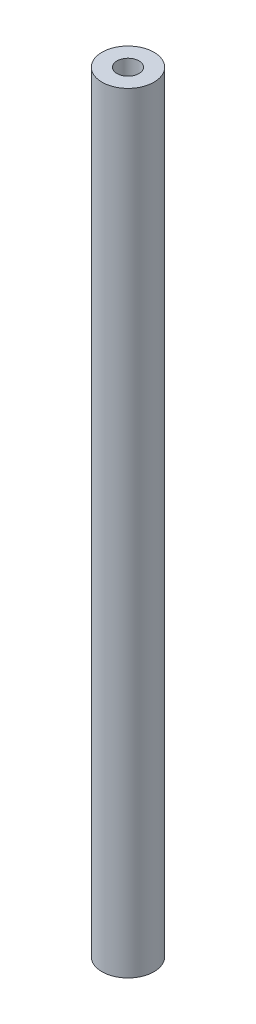
from build123d import *

# Parameters (mm, degrees)
SKETCH1_R           = 4.7625
SKETCH1_R_2         = 2.0193
BOSS_EXTRUDE1_DEPTH = 141.2875


with BuildPart() as part:
    # Sketch1 → Boss-Extrude1 (new body)
    with BuildSketch(Plane(origin=(0, 0, 0), x_dir=(1, 0, 0), z_dir=(0, 1, 0))):
        with Locations(Location((0, 0, 0), (0, 0, 270))):
            Circle(SKETCH1_R)
        with Locations(Location((0, 0, 0), (0, 0, 270))):
            Circle(SKETCH1_R_2, mode=Mode.SUBTRACT)
    extrude(amount=BOSS_EXTRUDE1_DEPTH)


solid = part.part
